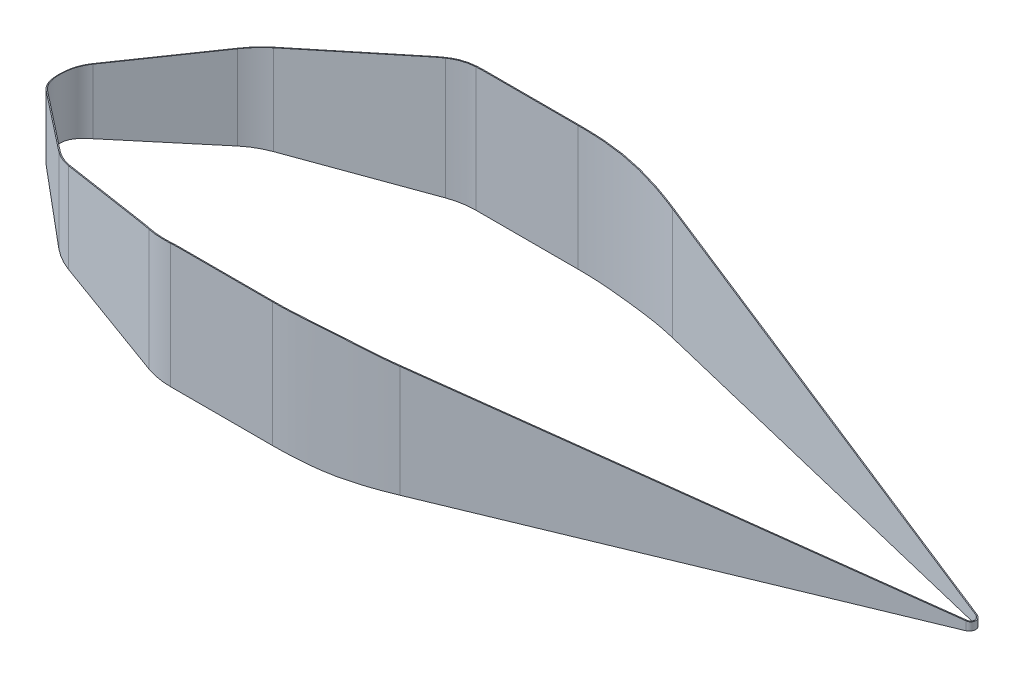
from build123d import *

# Parameters (mm, degrees)
TOPVIEW_EXTRUDE_DEPTH      = 800
SHELL1_T                   = -5
SIDEPROFILE_CUT_DEPTH      = 5006.775642449
SIDEPROFILE_CUT_DEPTH_BACK = 5006.775642449
SKETCH2_OUTSIDE_W          = 5811.458
SKETCH2_OUTSIDE_H          = 1824.126


with BuildPart() as part:
    # Sketch1 → TopView_Extrude (new body)
    with BuildSketch(Plane(origin=(0, 0, 0), x_dir=(1, 0, 0), z_dir=(0, 1, 0))):
        with BuildLine():
            Line((146.069849076, 122.567124227), (556.148324977, 466.663731547))
            ThreePointArc((556.148324977, 466.663731547), (613.263316637, 506.656075273), (676.455195963, 536.122941687))
            Line((676.455195963, 536.122941687), (1335.173700718, 775.877020708))
            ThreePointArc((1335.173700718, 775.877020708), (1402.522523085, 793.923094197), (1471.981833896, 800))
            Line((1471.981833896, 800), (2005.990858989, 800))
            ThreePointArc((2005.990858989, 800), (2298.278743763, 778.526672151), (2584.290234961, 714.567792414))
            Line((2584.290234961, 714.567792414), (4854.922001024, 28.718516886))
            ThreePointArc((4854.922001024, 28.718516886), (4876.247510385, 0), (4854.922001024, -28.718516886))
            Line((4854.922001024, -28.718516886), (2584.290234961, -714.567792414))
            ThreePointArc((2584.290234961, -714.567792414), (2298.278743763, -778.526672151), (2005.990858989, -800))
            Line((2005.990858989, -800), (1471.981833896, -800))
            ThreePointArc((1471.981833896, -800), (1402.522523085, -793.923094197), (1335.173700718, -775.877020708))
            Line((1335.173700718, -775.877020708), (676.455195963, -536.122941687))
            ThreePointArc((676.455195963, -536.122941687), (613.263316637, -506.656075273), (556.148324977, -466.663731547))
            Line((556.148324977, -466.663731547), (146.069849076, -122.567124227))
            ThreePointArc((146.069849076, -122.567124227), (88.915850742, 0), (146.069849076, 122.567124227))
        make_face()
    extrude(amount=TOPVIEW_EXTRUDE_DEPTH)

    # Shell1
    shell1_openings = [part.faces().sort_by_distance(p)[0] for p in [
        (2164.572912822, 800, 0),
        (2164.572912822, 0, 0),
    ]]
    offset(amount=SHELL1_T, openings=shell1_openings, kind=Kind.INTERSECTION)

    # Sketch2 outside → SideProfile_Cut (cut, two sides: drawn at the far end of the back side and taken through both)
    with BuildSketch(Plane.XY.offset(-SIDEPROFILE_CUT_DEPTH_BACK)):
        with Locations((2482.582, 400)):
            Rectangle(SKETCH2_OUTSIDE_W, SKETCH2_OUTSIDE_H)
        with BuildLine():
            Line((0, 300), (0, 332.854125267))
            ThreePointArc((0, 332.854125267), (31.780430043, 425.180358155), (113.65511039, 478.384359237))
            Line((113.65511039, 478.384359237), (1282.133703367, 770.201559797))
            ThreePointArc((1282.133703367, 770.201559797), (1402.370605908, 792.522432945), (1524.432967436, 800))
            Line((1524.432967436, 800), (2144.482683126, 800))
            ThreePointArc((2144.482683126, 800), (2300.969778196, 793.868548595), (2456.497380248, 775.511789076))
            Line((2456.497380248, 775.511789076), (4950, 381.685))
            Line((4950, 381.685), (4950, 359.158))
            Line((4950, 359.158), (2419.355991101, 159.311049986))
            ThreePointArc((2419.355991101, 159.311049986), (2301.359194606, 152.328666278), (2183.178929847, 150))
            Line((2183.178929847, 150), (150, 150))
            ThreePointArc((150, 150), (43.933982822, 193.933982822), (0, 300))
        make_face(mode=Mode.SUBTRACT)
    extrude(amount=SIDEPROFILE_CUT_DEPTH + SIDEPROFILE_CUT_DEPTH_BACK, mode=Mode.SUBTRACT)


solid = part.part
